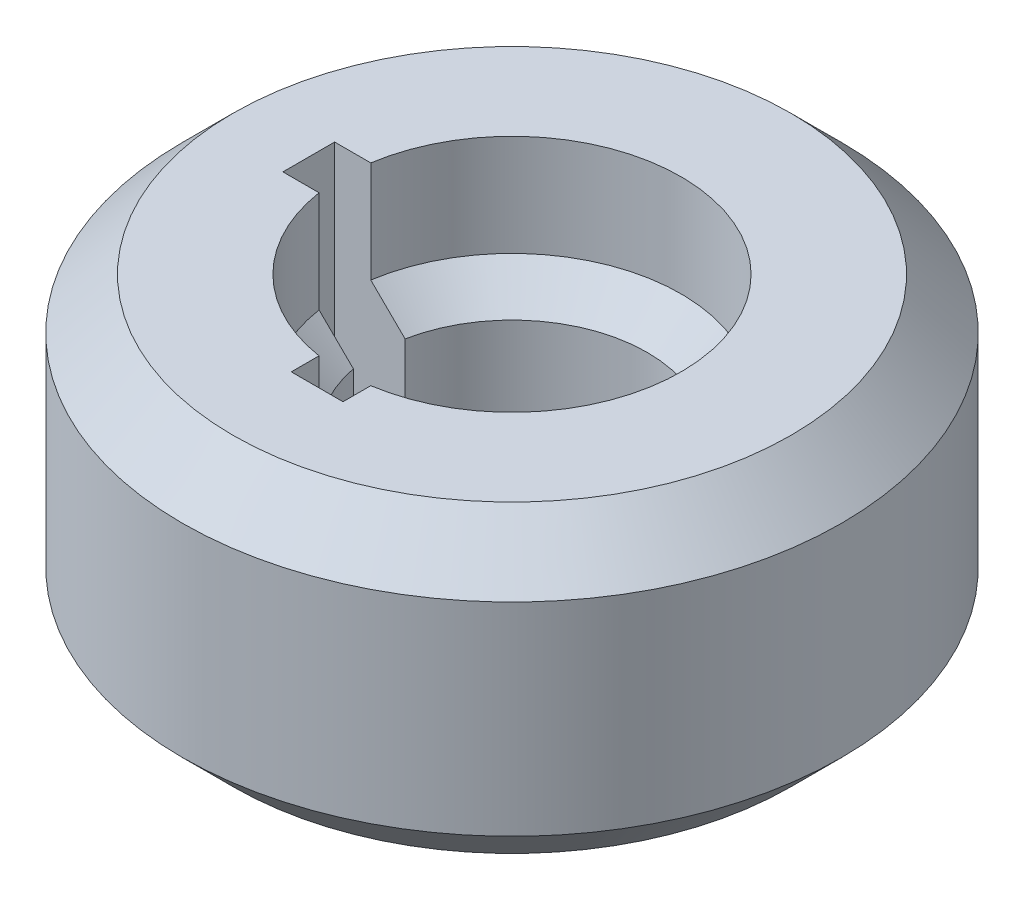
from build123d import *

# Parameters (mm, degrees)
CHAMFER2_SIZE      = 6
CUT_EXTRUDE2_DEPTH = 29
CHAMFER5_SIZE      = 6


with BuildPart() as part:
    # Sketch2 → Revolve2 (revolve)
    with BuildSketch(Plane.XY):
        Polygon((-16, -24.670336976), (-39, -24.670336976), (-39, 11.329663024), (-20, 11.329663024), (-20, -0.670336976), (-16, -4.670336976), align=None)
    revolve(axis=Axis((0, 25, 0), (0, -1, 0)))

    # Chamfer2
    chamfer2_edges = [part.edges().sort_by_distance(p)[0] for p in [
        (39, -24.670336976, 0),
    ]]
    chamfer(chamfer2_edges, length=CHAMFER2_SIZE)

    # Sketch8 → Cut-Extrude2 (cut, symmetric)
    with BuildSketch(Plane(origin=(0, 0, 0), x_dir=(1, 0, 0), z_dir=(0, 1, 0))):
        Polygon((3.06, 0), (0, 0), (0, -3.06), (-3.06, -3.06), (-3.06, -23.05), (3.06, -23.05), align=None)
        Polygon((-3.06, -3.06), (-3.06, 0), (0, 0), (0, 3.06), (-24.04, 3.06), (-24.04, -3.06), align=None)
    extrude(amount=CUT_EXTRUDE2_DEPTH, both=True, mode=Mode.SUBTRACT)

    # Chamfer5
    chamfer5_edges = [part.edges().sort_by_distance(p)[0] for p in [
        (39, 11.329663024, 0),
    ]]
    chamfer(chamfer5_edges, length=CHAMFER5_SIZE)


solid = part.part
